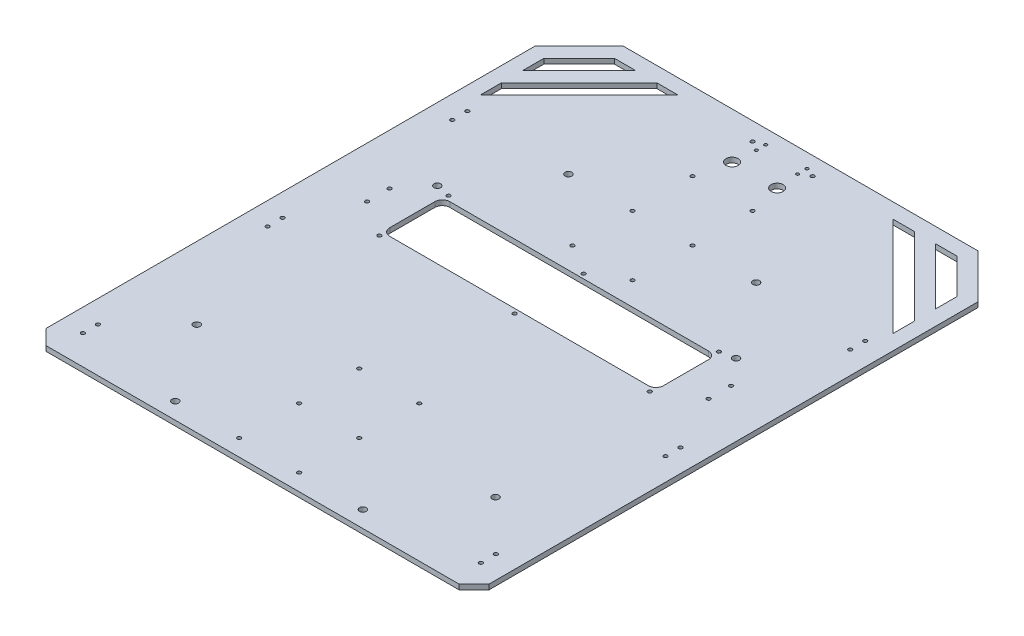
from build123d import *

# Parameters (mm, degrees)
SKETCH2_R           = 2.5
SKETCH2_R_2         = 4.5
SKETCH2_R_3         = 8
SKETCH2_R_4         = 2
BOSS_EXTRUDE1_DEPTH = 6.7


with BuildPart() as part:
    # Sketch2 → Boss-Extrude1 (new body)
    with BuildSketch(Plane(origin=(0, 0, 0), x_dir=(1, 0, 0), z_dir=(0, 1, 0))):
        Polygon((275.201010127, -365), (295, -345.201010127), (295, 306.310137162), (236.310137162, 365), (-236.310137162, 365), (-295, 306.310137162), (-295, -345.201010127), (-275.201010127, -365), align=None)
        with Locations(Location((-265, -326, 0), (0, 0, 270))):
            Circle(SKETCH2_R, mode=Mode.SUBTRACT)
        with Locations(Location((-265, -306, 0), (0, 0, 270))):
            Circle(SKETCH2_R, mode=Mode.SUBTRACT)
        with Locations(Location((-199, -240.38125, 0), (0, 0, 270))):
            Circle(SKETCH2_R_2, mode=Mode.SUBTRACT)
        with Locations(Location((-125, -343, 0), (0, 0, 270))):
            Circle(SKETCH2_R_2, mode=Mode.SUBTRACT)
        with Locations(Location((-40, -343, 0), (0, 0, 270))):
            Circle(SKETCH2_R, mode=Mode.SUBTRACT)
        with Locations(Location((-40, -263, 0), (0, 0, 270))):
            Circle(SKETCH2_R, mode=Mode.SUBTRACT)
        with Locations(Location((-40, -183, 0), (0, 0, 270))):
            Circle(SKETCH2_R, mode=Mode.SUBTRACT)
        with Locations(Location((-265, -80, 0), (0, 0, 270))):
            Circle(SKETCH2_R, mode=Mode.SUBTRACT)
        with Locations(Location((-265, -60, 0), (0, 0, 270))):
            Circle(SKETCH2_R, mode=Mode.SUBTRACT)
        with Locations(Location((-180, -16, 0), (0, 0, 270))):
            Circle(SKETCH2_R, mode=Mode.SUBTRACT)
        with Locations(Location((40, -343, 0), (0, 0, 270))):
            Circle(SKETCH2_R, mode=Mode.SUBTRACT)
        with Locations(Location((125, -343, 0), (0, 0, 270))):
            Circle(SKETCH2_R_2, mode=Mode.SUBTRACT)
        with Locations(Location((40, -263, 0), (0, 0, 270))):
            Circle(SKETCH2_R, mode=Mode.SUBTRACT)
        with Locations(Location((40, -183, 0), (0, 0, 270))):
            Circle(SKETCH2_R, mode=Mode.SUBTRACT)
        with Locations(Location((265, -326, 0), (0, 0, 270))):
            Circle(SKETCH2_R, mode=Mode.SUBTRACT)
        with Locations(Location((265, -306, 0), (0, 0, 270))):
            Circle(SKETCH2_R, mode=Mode.SUBTRACT)
        with Locations(Location((199, -240.38125, 0), (0, 0, 270))):
            Circle(SKETCH2_R_2, mode=Mode.SUBTRACT)
        with Locations(Location((0, -16, 0), (0, 0, 270))):
            Circle(SKETCH2_R, mode=Mode.SUBTRACT)
        with Locations(Location((180, -16, 0), (0, 0, 270))):
            Circle(SKETCH2_R, mode=Mode.SUBTRACT)
        with Locations(Location((265, -80, 0), (0, 0, 270))):
            Circle(SKETCH2_R, mode=Mode.SUBTRACT)
        with Locations(Location((265, -60, 0), (0, 0, 270))):
            Circle(SKETCH2_R, mode=Mode.SUBTRACT)
        with Locations(Location((-227.53125, 15, 0), (0, 0, 270))):
            Circle(SKETCH2_R, mode=Mode.SUBTRACT)
        with Locations(Location((-227.53125, 45, 0), (0, 0, 270))):
            Circle(SKETCH2_R, mode=Mode.SUBTRACT)
        with Locations(Location((-199, 80, 0), (0, 0, 270))):
            Circle(SKETCH2_R_2, mode=Mode.SUBTRACT)
        with Locations(Location((-180, 76, 0), (0, 0, 270))):
            Circle(SKETCH2_R, mode=Mode.SUBTRACT)
        with Locations(Location((-265, 166, 0), (0, 0, 270))):
            Circle(SKETCH2_R, mode=Mode.SUBTRACT)
        with Locations(Location((-125, 180.703125, 0), (0, 0, 270))):
            Circle(SKETCH2_R_2, mode=Mode.SUBTRACT)
        with Locations(Location((-40, 101, 0), (0, 0, 270))):
            Circle(SKETCH2_R, mode=Mode.SUBTRACT)
        with Locations(Location((-40, 181, 0), (0, 0, 270))):
            Circle(SKETCH2_R, mode=Mode.SUBTRACT)
        with Locations(Location((-265, 186, 0), (0, 0, 270))):
            Circle(SKETCH2_R, mode=Mode.SUBTRACT)
        Polygon((-275, 269.741594667), (-275, 298.025865914), (-228.025865914, 345), (-199.741594667, 345), align=None, mode=Mode.SUBTRACT)
        Polygon((-143.173052172, 345), (-275, 213.173052172), (-275, 241.457323419), (-171.457323419, 345), align=None, mode=Mode.SUBTRACT)
        with Locations(Location((-40, 261, 0), (0, 0, 270))):
            Circle(SKETCH2_R, mode=Mode.SUBTRACT)
        with Locations(Location((-30, 303.734375, 0), (0, 0, 270))):
            Circle(SKETCH2_R_3, mode=Mode.SUBTRACT)
        with Locations(Location((-40, 341, 0), (0, 0, 270))):
            Circle(SKETCH2_R, mode=Mode.SUBTRACT)
        with Locations(Location((-27.5, 333.5, 0), (0, 0, 270))):
            Circle(SKETCH2_R_4, mode=Mode.SUBTRACT)
        with Locations(Location((-27.5, 346, 0), (0, 0, 270))):
            Circle(SKETCH2_R_4, mode=Mode.SUBTRACT)
        with BuildLine():
            Line((172.2875, -10), (-172.2875, -10))
            ThreePointArc((-172.2875, -10), (-179.358567812, -7.071067812), (-182.2875, 0))
            Line((-182.2875, 0), (-182.2875, 60))
            ThreePointArc((-182.2875, 60), (-179.358567812, 67.071067812), (-172.2875, 70))
            Line((-172.2875, 70), (172.2875, 70))
            ThreePointArc((172.2875, 70), (179.358567812, 67.071067812), (182.2875, 60))
            Line((182.2875, 60), (182.2875, 0))
            ThreePointArc((182.2875, 0), (179.358567812, -7.071067812), (172.2875, -10))
        make_face(mode=Mode.SUBTRACT)
        with Locations(Location((0, 76, 0), (0, 0, 270))):
            Circle(SKETCH2_R, mode=Mode.SUBTRACT)
        with Locations(Location((40, 101, 0), (0, 0, 270))):
            Circle(SKETCH2_R, mode=Mode.SUBTRACT)
        with Locations(Location((40, 181, 0), (0, 0, 270))):
            Circle(SKETCH2_R, mode=Mode.SUBTRACT)
        with Locations(Location((125, 180.703125, 0), (0, 0, 270))):
            Circle(SKETCH2_R_2, mode=Mode.SUBTRACT)
        with Locations(Location((180, 76, 0), (0, 0, 270))):
            Circle(SKETCH2_R, mode=Mode.SUBTRACT)
        with Locations(Location((199, 80, 0), (0, 0, 270))):
            Circle(SKETCH2_R_2, mode=Mode.SUBTRACT)
        with Locations(Location((227.53125, 15, 0), (0, 0, 270))):
            Circle(SKETCH2_R, mode=Mode.SUBTRACT)
        with Locations(Location((227.53125, 45, 0), (0, 0, 270))):
            Circle(SKETCH2_R, mode=Mode.SUBTRACT)
        with Locations(Location((265, 166, 0), (0, 0, 270))):
            Circle(SKETCH2_R, mode=Mode.SUBTRACT)
        with Locations(Location((40, 261, 0), (0, 0, 270))):
            Circle(SKETCH2_R, mode=Mode.SUBTRACT)
        with Locations(Location((30, 303.734375, 0), (0, 0, 270))):
            Circle(SKETCH2_R_3, mode=Mode.SUBTRACT)
        with Locations(Location((27.5, 333.5, 0), (0, 0, 270))):
            Circle(SKETCH2_R_4, mode=Mode.SUBTRACT)
        with Locations(Location((27.5, 346, 0), (0, 0, 270))):
            Circle(SKETCH2_R_4, mode=Mode.SUBTRACT)
        with Locations(Location((40, 341, 0), (0, 0, 270))):
            Circle(SKETCH2_R, mode=Mode.SUBTRACT)
        with Locations(Location((265, 186, 0), (0, 0, 270))):
            Circle(SKETCH2_R, mode=Mode.SUBTRACT)
        Polygon((143.173052172, 345), (171.457323419, 345), (275, 241.457323419), (275, 213.173052172), align=None, mode=Mode.SUBTRACT)
        Polygon((199.741594667, 345), (228.025865914, 345), (275, 298.025865914), (275, 269.741594667), align=None, mode=Mode.SUBTRACT)
    extrude(amount=BOSS_EXTRUDE1_DEPTH)


solid = part.part
